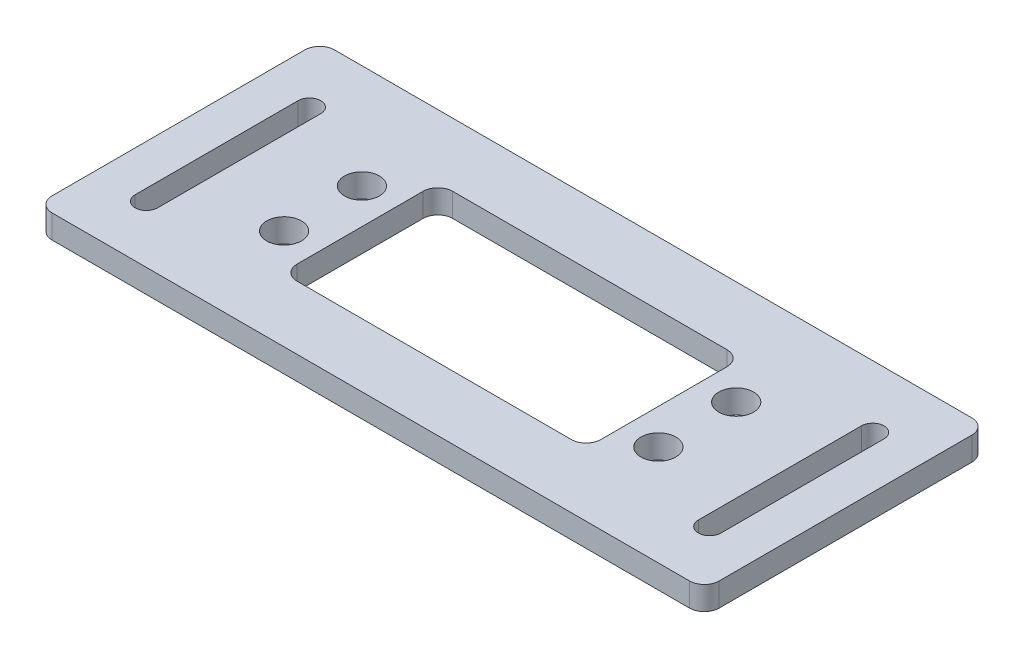
from build123d import *

# Parameters (mm, degrees)
SKETCH1_W           = 90
SKETCH1_H           = 38.1
BOSS_EXTRUDE1_DEPTH = 3.175
SKETCH2_R           = 2.35
SKETCH2_W           = 41
SKETCH2_H           = 21
CUT_EXTRUDE1_DEPTH  = 49.969205885
FILLET1_R           = 2
CUT_EXTRUDE2_DEPTH  = 49.969205885


with BuildPart() as part:
    # Sketch1 → Boss-Extrude1 (new body)
    with BuildSketch(Plane(origin=(0, 0, 0), x_dir=(1, 0, 0), z_dir=(0, 1, 0))):
        Rectangle(SKETCH1_W, SKETCH1_H)
    extrude(amount=BOSS_EXTRUDE1_DEPTH)

    # Sketch2 → Cut-Extrude1 (cut, through all)
    with BuildSketch(Plane(origin=(0, 3.175, 0), x_dir=(1, 0, 0), z_dir=(0, 1, 0))):
        with Locations(Location((-25.25, 5, 0), (0, 0, 270))):
            Circle(SKETCH2_R)
        with Locations(Location((-25.25, -5.503329438, 0), (0, 0, 270))):
            Circle(SKETCH2_R)
        with Locations(Location((25.25, 5, 0), (0, 0, 90))):
            Circle(SKETCH2_R)
        with Locations(Location((25.25, -5.503329438, 0), (0, 0, 90))):
            Circle(SKETCH2_R)
        Rectangle(SKETCH2_W, SKETCH2_H)
    extrude(amount=-CUT_EXTRUDE1_DEPTH, mode=Mode.SUBTRACT)

    # Fillet1
    fillet1_edges = [part.edges().sort_by_distance(p)[0] for p in [
        (-20.5, 1.5875, 10.5),
        (-20.5, 1.5875, -10.5),
        (20.5, 1.5875, -10.5),
        (20.5, 1.5875, 10.5),
        (-45, 1.5875, -19.05),
        (45, 1.5875, -19.05),
        (45, 1.5875, 19.05),
        (-45, 1.5875, 19.05),
    ]]
    fillet(fillet1_edges, radius=FILLET1_R)

    # Sketch3 → Cut-Extrude2 (cut, through all)
    with BuildSketch(Plane(origin=(0, 3.175, 0), x_dir=(1, 0, 0), z_dir=(0, 1, 0))):
        with BuildLine():
            Line((-36.475, 10.670041553), (-36.475, -11.329958447))
            ThreePointArc((-36.475, -11.329958447), (-38, -12.854958447), (-39.525, -11.329958447))
            Line((-39.525, -11.329958447), (-39.525, 10.670041553))
            ThreePointArc((-39.525, 10.670041553), (-38, 12.195041553), (-36.475, 10.670041553))
        make_face()
        with BuildLine():
            Line((36.475, 10.670041553), (36.475, -11.329958447))
            ThreePointArc((36.475, -11.329958447), (38, -12.854958447), (39.525, -11.329958447))
            Line((39.525, -11.329958447), (39.525, 10.670041553))
            ThreePointArc((39.525, 10.670041553), (38, 12.195041553), (36.475, 10.670041553))
        make_face()
    extrude(amount=-CUT_EXTRUDE2_DEPTH, mode=Mode.SUBTRACT)


solid = part.part
